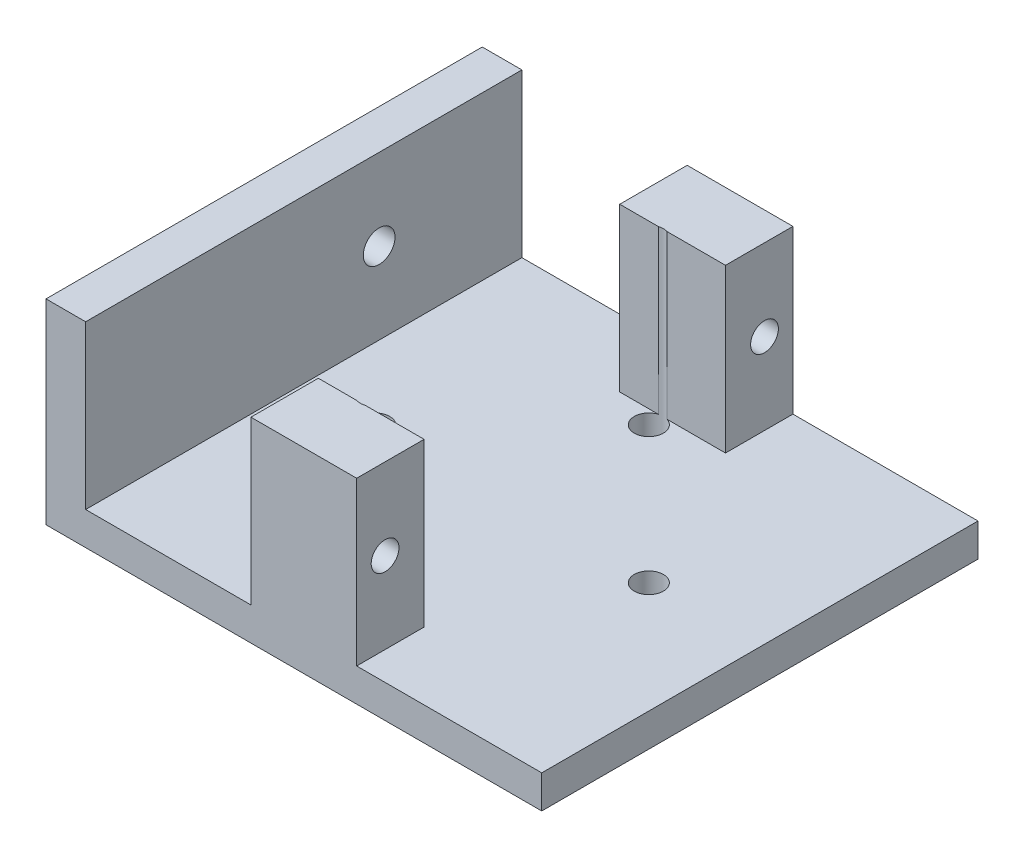
from build123d import *

# Parameters (mm, degrees)
SKIZZE1_W                       = 37.5
SKIZZE1_H                       = 33
AUFSATZ_LINEAR_AUSTRAGEN1_DEPTH = 2.5
SKIZZE2_W                       = 3
SKIZZE2_H                       = 33
SKIZZE2_W_2                     = 8
SKIZZE2_H_2                     = 5.1
AUFSATZ_LINEAR_AUSTRAGEN2_DEPTH = 12.3
SCHNITT_LINEAR_AUSTRAGEN3_DEPTH = 30.031922086
SKIZZE5_R                       = 1.2
SCHNITT_LINEAR_AUSTRAGEN4_DEPTH = 42.006584837
SKIZZE7_R                       = 1.05
SCHNITT_LINEAR_AUSTRAGEN5_DEPTH = 10


with BuildPart() as part:
    # Skizze1 → Aufsatz-Linear austragen1 (new body)
    with BuildSketch(Plane(origin=(0, 0, 0), x_dir=(1, 0, 0), z_dir=(0, 1, 0))):
        Rectangle(SKIZZE1_W, SKIZZE1_H)
    extrude(amount=AUFSATZ_LINEAR_AUSTRAGEN1_DEPTH)

    # Skizze2 → Aufsatz-Linear austragen2 (add)
    with BuildSketch(Plane(origin=(0, 2.5, 0), x_dir=(1, 0, 0), z_dir=(0, 1, 0))):
        with Locations((-17.25, 0)):
            Rectangle(SKIZZE2_W, SKIZZE2_H)
        with Locations((0.75, -13.95)):
            Rectangle(SKIZZE2_W_2, SKIZZE2_H_2)
        with Locations((0.75, 13.95)):
            Rectangle(SKIZZE2_W_2, SKIZZE2_H_2)
    extrude(amount=AUFSATZ_LINEAR_AUSTRAGEN2_DEPTH)

    # Skizze6 → Schnitt-Linear austragen3 (cut, through all)
    with BuildSketch(Plane.XZ):
        with BuildLine():
            ThreePointArc((-10.291545894, -1.098445774), (-9.551783389, -0.756868708), (-9.25, 0))
            ThreePointArc((-9.25, 0), (-9.551783389, 0.756868708), (-10.291545894, 1.098445774))
            ThreePointArc((-10.291545894, 1.098445774), (-10.35, 0), (-10.291545894, -1.098445774))
        make_face()
        with BuildLine():
            ThreePointArc((-10.291545894, -1.098445774), (-10.35, 0), (-10.291545894, 1.098445774))
            ThreePointArc((-10.291545894, 1.098445774), (-11.45, 0), (-10.291545894, -1.098445774))
        make_face()
        with BuildLine():
            ThreePointArc((-1.098445774, 10.291545894), (0, 9.25), (1.098445774, 10.291545894))
            ThreePointArc((1.098445774, 10.291545894), (0, 10.35), (-1.098445774, 10.291545894))
        make_face()
        with BuildLine():
            ThreePointArc((-1.098445774, 10.291545894), (0, 10.35), (1.098445774, 10.291545894))
            ThreePointArc((1.098445774, 10.291545894), (1.099611375, 10.320762617), (1.1, 10.35))
            ThreePointArc((1.1, 10.35), (-0.029237383, 11.449611375), (-1.098445774, 10.291545894))
        make_face()
        with BuildLine():
            ThreePointArc((10.291545894, -1.098445774), (11.106868708, -0.798216611), (11.45, 0))
            ThreePointArc((11.45, 0), (11.106868708, 0.798216611), (10.291545894, 1.098445774))
            ThreePointArc((10.291545894, 1.098445774), (10.35, 0), (10.291545894, -1.098445774))
        make_face()
        with BuildLine():
            ThreePointArc((10.291545894, -1.098445774), (10.35, 0), (10.291545894, 1.098445774))
            ThreePointArc((10.291545894, 1.098445774), (9.25, 0), (10.291545894, -1.098445774))
        make_face()
        with BuildLine():
            ThreePointArc((-1.098445774, -10.291545894), (-0.029237383, -11.449611375), (1.1, -10.35))
            ThreePointArc((1.1, -10.35), (1.099611375, -10.320762617), (1.098445774, -10.291545894))
            ThreePointArc((1.098445774, -10.291545894), (0, -10.35), (-1.098445774, -10.291545894))
        make_face()
        with BuildLine():
            ThreePointArc((-1.098445774, -10.291545894), (0, -10.35), (1.098445774, -10.291545894))
            ThreePointArc((1.098445774, -10.291545894), (0, -9.25), (-1.098445774, -10.291545894))
        make_face()
    extrude(amount=-SCHNITT_LINEAR_AUSTRAGEN3_DEPTH, mode=Mode.SUBTRACT)

    # Skizze5 → Schnitt-Linear austragen4 (cut, through all)
    with BuildSketch(Plane(origin=(-15.75, 0, 0), x_dir=(0, 0, -1), z_dir=(1, 0, 0))):
        with Locations((5.7, 8.65)):
            Circle(SKIZZE5_R)
    extrude(amount=-SCHNITT_LINEAR_AUSTRAGEN4_DEPTH, mode=Mode.SUBTRACT)

    # Skizze7 → Schnitt-Linear austragen5 (cut)
    with BuildSketch(Plane(origin=(4.75, 0, 0), x_dir=(0, 0, -1), z_dir=(1, 0, 0))):
        with Locations((-14.35, 8.65)):
            Circle(SKIZZE7_R)
        with Locations((14.35, 8.65)):
            Circle(SKIZZE7_R)
    extrude(amount=-SCHNITT_LINEAR_AUSTRAGEN5_DEPTH, mode=Mode.SUBTRACT)


solid = part.part
